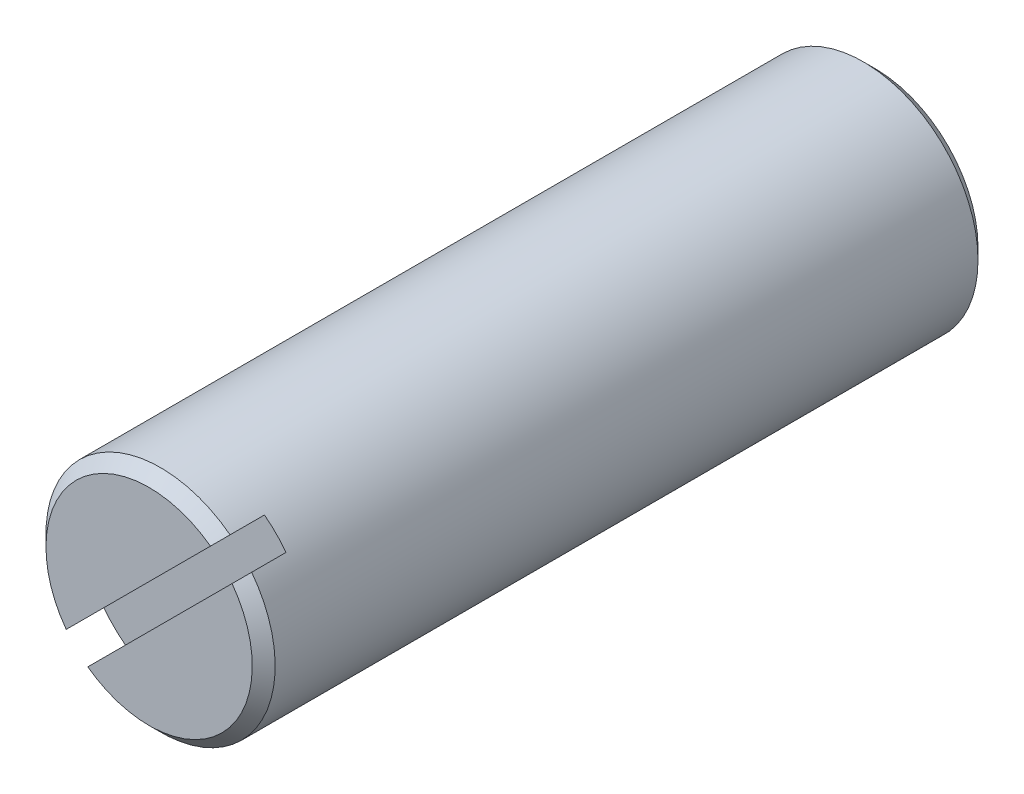
from build123d import *

# Parameters (mm, degrees)
ESQUISSE1_R          = 15
BASE_EXTRUSION_DEPTH = 95
CHANFREIN1_SIZE      = 1.5
ESQUISSE2_W          = 55
ESQUISSE2_H          = 5
M_PLAT_DEPTH         = 101.747208398
RAINURE_DEPTH        = 6


with BuildPart() as part:
    # Esquisse1 → Base-Extrusion (new body)
    with BuildSketch(Plane.XY):
        Circle(ESQUISSE1_R)
    extrude(amount=BASE_EXTRUSION_DEPTH)

    # Chanfrein1
    chanfrein1_edges = [part.edges().sort_by_distance(p)[0] for p in [
        (-15, 0, 0),
        (-15, 0, 95),
    ]]
    chamfer(chanfrein1_edges, length=CHANFREIN1_SIZE)

    # Esquisse2 → Méplat (cut, through all)
    with BuildSketch(Plane(origin=(15, 0, 0), x_dir=(0, 0, -1), z_dir=(1, 0, 0))):
        with Locations((-47.5, -15.5)):
            Rectangle(ESQUISSE2_W, ESQUISSE2_H)
    extrude(amount=-M_PLAT_DEPTH, mode=Mode.SUBTRACT)

    # Esquisse3 → Rainure (cut)
    with BuildSketch(Plane.XY.offset(95)):
        Polygon((-10.960155108, -13.788582233), (13.788582233, 10.960155108), (10.960155108, 13.788582233), (-13.788582233, -10.960155108), align=None)
    extrude(amount=-RAINURE_DEPTH, mode=Mode.SUBTRACT)


solid = part.part
